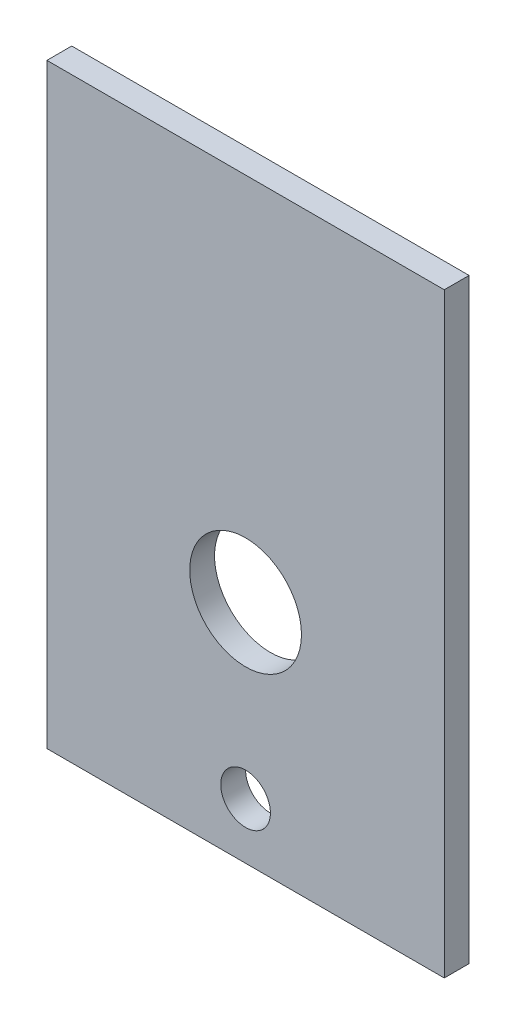
from build123d import *

# Parameters (mm, degrees)
SKETCH1_W           = 101.6
SKETCH1_H           = 152.4
SKETCH1_R           = 14.2875
SKETCH1_R_2         = 6.35
BOSS_EXTRUDE1_DEPTH = 6.35


with BuildPart() as part:
    # Sketch1 → Boss-Extrude1 (new body)
    with BuildSketch(Plane.XY):
        with Locations((50.8, 76.2)):
            Rectangle(SKETCH1_W, SKETCH1_H)
        with Locations((50.8, 57.785)):
            Circle(SKETCH1_R, mode=Mode.SUBTRACT)
        with Locations((50.8, 14.2875)):
            Circle(SKETCH1_R_2, mode=Mode.SUBTRACT)
    extrude(amount=BOSS_EXTRUDE1_DEPTH)


solid = part.part
